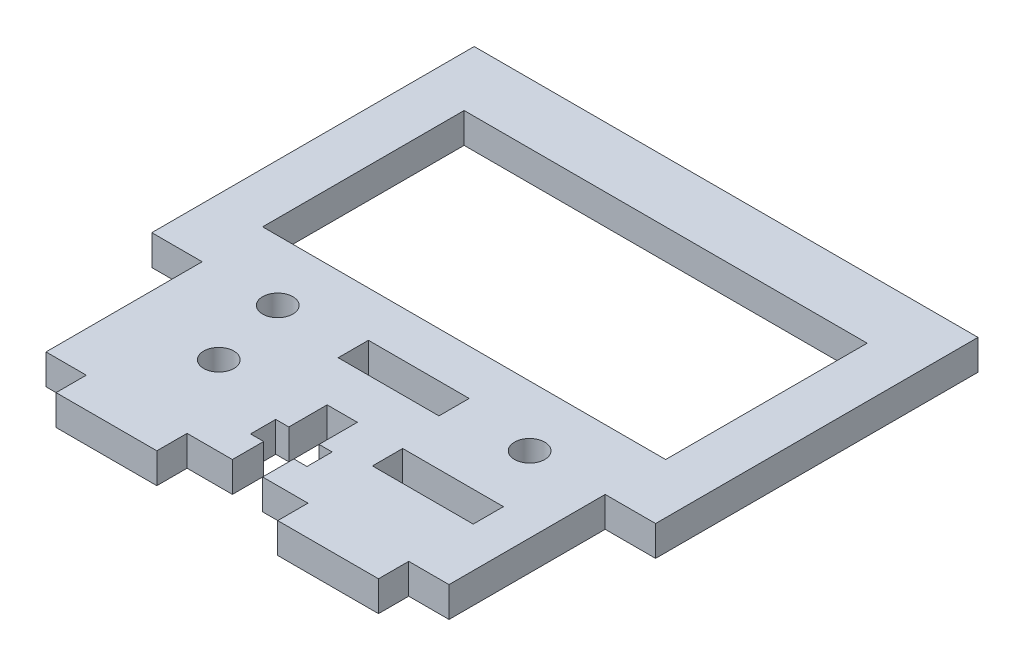
from build123d import *

# Parameters (mm, degrees)
SKETCH2_R           = 1.5
SKETCH2_W           = 40
SKETCH2_H           = 20
SKETCH2_W_2         = 10
SKETCH2_H_2         = 3
BOSS_EXTRUDE1_DEPTH = 3


with BuildPart() as part:
    # Sketch2 → Boss-Extrude1 (new body)
    with BuildSketch(Plane(origin=(0, 0, 0), x_dir=(1, 0, 0), z_dir=(0, 1, 0))):
        Polygon((0, 15.5), (5, 15.5), (5, 47.5), (-45, 47.5), (-45, 15.5), (-40, 15.5), (-40, 0), (-36, 0), (-36, -3), (-26, -3), (-26, 0), (-21.5, 0), (-21.5, 3.1), (-22.8, 3.1), (-22.8, 5.6), (-21.5, 5.6), (-21.5, 9.4), (-18.5, 9.4), (-18.5, 5.6), (-17.2, 5.6), (-17.2, 3.1), (-18.5, 3.1), (-18.5, 0), (-14, 0), (-14, -3), (-4, -3), (-4, 0), (0, 0), align=None)
        with Locations(Location((-7.5, 15.5, 0), (0, 0, 270))):
            Circle(SKETCH2_R, mode=Mode.SUBTRACT)
        with Locations(Location((-32.5, 15.5, 0), (0, 0, 270))):
            Circle(SKETCH2_R, mode=Mode.SUBTRACT)
        with Locations(Location((-30.75, 7.9, 0), (0, 0, 270))):
            Circle(SKETCH2_R, mode=Mode.SUBTRACT)
        with Locations((-20, 31.5)):
            Rectangle(SKETCH2_W, SKETCH2_H, mode=Mode.SUBTRACT)
        with Locations((-20, 15.5)):
            Rectangle(SKETCH2_W_2, SKETCH2_H_2, mode=Mode.SUBTRACT)
        with Locations((-9, 7.9)):
            Rectangle(SKETCH2_W_2, SKETCH2_H_2, mode=Mode.SUBTRACT)
    extrude(amount=BOSS_EXTRUDE1_DEPTH)


solid = part.part
